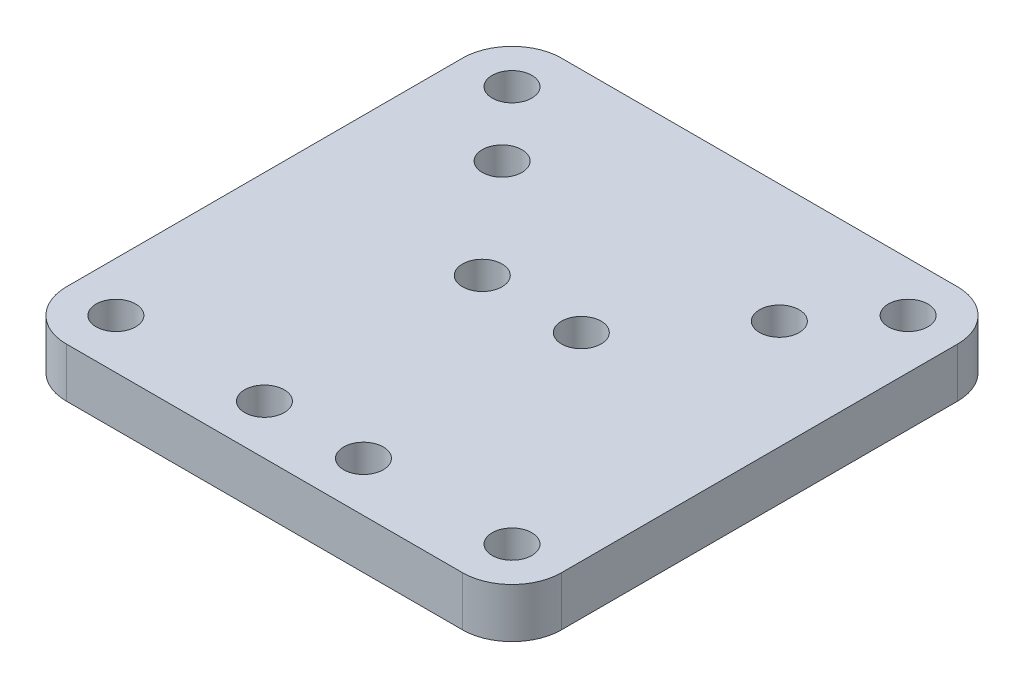
from build123d import *

# Parameters (mm, degrees)
ESQUISSE1_W             = 50
ESQUISSE1_H             = 50
ESQUISSE1_R             = 2
BOSS_EXTRU_1_DEPTH      = 5
CONG_1_R                = 5
ESQUISSE2_R             = 2
ENL_V_MAT_EXTRU_1_DEPTH = 10


with BuildPart() as part:
    # Esquisse1 → Boss.-Extru.1 (new body)
    with BuildSketch(Plane(origin=(0, 0, 0), x_dir=(1, 0, 0), z_dir=(0, 1, 0))):
        Rectangle(ESQUISSE1_W, ESQUISSE1_H)
        with Locations(Location((-5, -20, 0), (0, 0, 270))):
            Circle(ESQUISSE1_R, mode=Mode.SUBTRACT)
        with Locations(Location((5, -20, 0), (0, 0, 270))):
            Circle(ESQUISSE1_R, mode=Mode.SUBTRACT)
        with Locations(Location((-5, 2, 0), (0, 0, 270))):
            Circle(ESQUISSE1_R, mode=Mode.SUBTRACT)
        with Locations(Location((5, 2, 0), (0, 0, 270))):
            Circle(ESQUISSE1_R, mode=Mode.SUBTRACT)
    extrude(amount=BOSS_EXTRU_1_DEPTH)

    # Congé1
    cong_1_edges = [part.edges().sort_by_distance(p)[0] for p in [
        (-25, 2.5, -25),
        (25, 2.5, -25),
        (25, 2.5, 25),
        (-25, 2.5, 25),
    ]]
    fillet(cong_1_edges, radius=CONG_1_R)

    # Esquisse2 → Enlèv. mat.-Extru.1 (cut)
    with BuildSketch(Plane(origin=(0, 5, 0), x_dir=(1, 0, 0), z_dir=(0, 1, 0))):
        with Locations(Location((-20, 20, 0), (0, 0, 270))):
            Circle(ESQUISSE2_R)
        with Locations(Location((-20, -20, 0), (0, 0, 270))):
            Circle(ESQUISSE2_R)
        with Locations(Location((20, -20, 0), (0, 0, 270))):
            Circle(ESQUISSE2_R)
        with Locations(Location((20, 20, 0), (0, 0, 270))):
            Circle(ESQUISSE2_R)
        with Locations(Location((-14, 13, 0), (0, 0, 270))):
            Circle(ESQUISSE2_R)
        with Locations(Location((14, 13, 0), (0, 0, 270))):
            Circle(ESQUISSE2_R)
    extrude(amount=-ENL_V_MAT_EXTRU_1_DEPTH, mode=Mode.SUBTRACT)


solid = part.part
